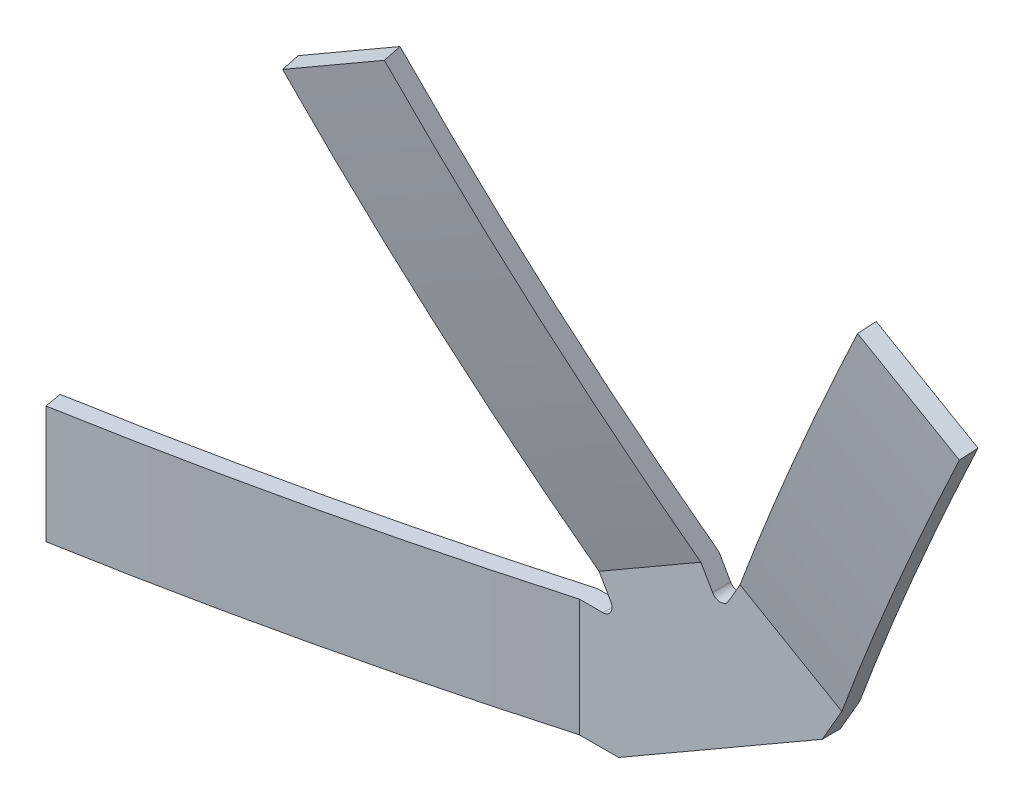
from build123d import *

# Parameters (mm, degrees)
AUFSATZ_LINEAR_AUSTRAGEN1_DEPTH = 2
AUFSATZ_LINEAR_AUSTRAGEN5_DEPTH = 13
KREISMUSTER3_COUNT              = 3
KREISMUSTER3_ANGLE              = 120


with BuildPart() as part:
    # Skizze1 → Aufsatz-Linear austragen1 (new body)
    with BuildSketch(Plane.XY):
        with BuildLine():
            Line((29.011851027, 10.25), (28.145825623, 10.75))
            Line((28.145825623, 10.75), (25.547749412, 12.25))
            Line((25.547749412, 12.25), (21.217622393, 14.75))
            Line((21.217622393, 14.75), (18.619546181, 16.25))
            Line((18.619546181, 16.25), (17.753520778, 16.75))
            Line((17.753520778, 16.75), (16.454482672, 14.5))
            ThreePointArc((16.454482672, 14.5), (15.588457268, 14), (14.722431864, 14.5))
            Line((14.722431864, 14.5), (13.423393759, 16.75))
            Line((13.423393759, 16.75), (12.557368355, 16.25))
            Line((12.557368355, 16.25), (9.959292144, 14.75))
            Line((9.959292144, 14.75), (5.629165125, 12.25))
            Line((5.629165125, 12.25), (3.031088913, 10.75))
            Line((3.031088913, 10.75), (2.165063509, 10.25))
            Line((2.165063509, 10.25), (3.464101615, 8))
            ThreePointArc((3.464101615, 8), (3.464101615, 7), (2.598076211, 6.5))
            Line((2.598076211, 6.5), (0, 6.5))
            Line((0, 6.5), (0, 5.5))
            Line((0, 5.5), (0, 2.5))
            Line((0, 2.5), (0, -2.5))
            Line((0, -2.5), (0, -5.5))
            Line((0, -5.5), (0, -6.5))
            Line((0, -6.5), (4.330127019, -6.5))
            Line((4.330127019, -6.5), (6.92820323, -5))
            Line((6.92820323, -5), (24.248711306, 5))
            Line((24.248711306, 5), (26.846787517, 6.5))
            Line((26.846787517, 6.5), (29.011851027, 10.25))
        make_face()
    extrude(amount=AUFSATZ_LINEAR_AUSTRAGEN1_DEPTH)

    # Skizze6 → Aufsatz-Linear austragen5 (add)
    with BuildSketch(Plane.XZ.offset(6.5)):
        with BuildLine():
            Line((-48.004683363, 13), (-48.338732237, 11.105224302))
            ThreePointArc((-48.338732237, 11.105224302), (-24.026875813, 6.172842822), (0, 0))
            Line((0, 0), (0, 2))
            ThreePointArc((0, 2), (-23.862752465, 8.109176013), (-48.004683363, 13))
        make_face()
    aufsatz_linear_austragen5 = extrude(amount=-AUFSATZ_LINEAR_AUSTRAGEN5_DEPTH)

    # Kreismuster3: Aufsatz-Linear austragen5 ×3 about axis
    kreismuster3_axis = Axis((15.588457268, 0, 0), (0, 0, -1))
    for i in range(1, KREISMUSTER3_COUNT):
        add(aufsatz_linear_austragen5.rotate(kreismuster3_axis, i * KREISMUSTER3_ANGLE / (KREISMUSTER3_COUNT - 1)))


solid = part.part
